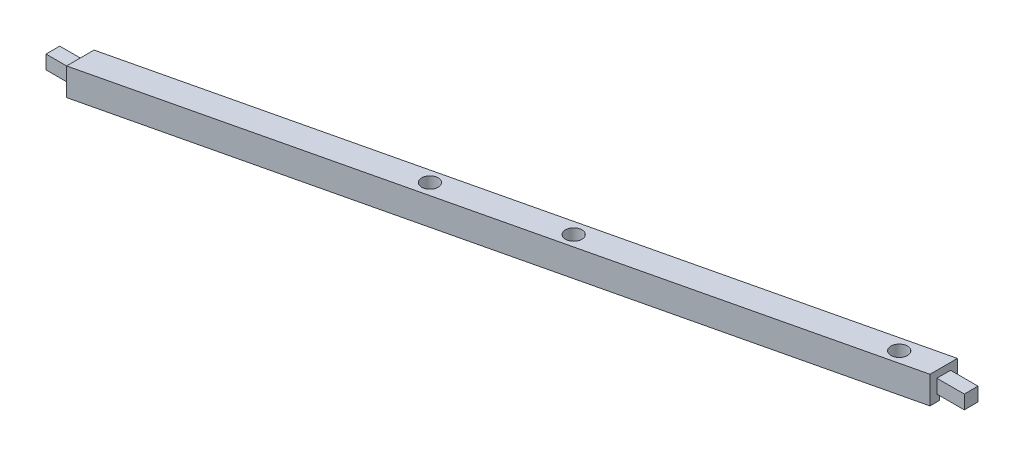
from build123d import *

# Parameters (mm, degrees)
BOSS_EXTRUDE1_DEPTH = 5
SKETCH2_W           = 2.5
SKETCH2_H           = 2.5
BOSS_EXTRUDE2_DEPTH = 5
SKETCH3_W           = 2.5
SKETCH3_H           = 2.5
BOSS_EXTRUDE3_DEPTH = 5
SKETCH6_R           = 1.5
CUT_EXTRUDE1_DEPTH  = 5
CUT_EXTRUDE2_DEPTH  = 2


with BuildPart() as part:
    # Sketch1 → Boss-Extrude1 (new body)
    with BuildSketch(Plane(origin=(0, 0, 0), x_dir=(1, 0, 0), z_dir=(0, 1, 0))):
        Polygon((0, 5), (0, 0), (127.3, 30), (127.3, 35), align=None)
    extrude(amount=BOSS_EXTRUDE1_DEPTH)

    # Sketch2 → Boss-Extrude2 (add)
    with BuildSketch(Plane(origin=(127.3, 0, 0), x_dir=(0, 0, -1), z_dir=(1, 0, 0))):
        with Locations((32.5, 2.5)):
            Rectangle(SKETCH2_W, SKETCH2_H)
    extrude(amount=BOSS_EXTRUDE2_DEPTH)

    # Sketch3 → Boss-Extrude3 (add)
    with BuildSketch(Plane.ZY):
        with Locations((-2.5, 2.5)):
            Rectangle(SKETCH3_W, SKETCH3_H)
    extrude(amount=BOSS_EXTRUDE3_DEPTH)

    # Sketch6 → Cut-Extrude1 (cut)
    with BuildSketch(Plane.XZ):
        with Locations(Location((51.5, -14.705168766, 0), (0, 0, 270))):
            Circle(SKETCH6_R)
        with Locations(Location((72.8, -19.587839875, 0), (0, 0, 270))):
            Circle(SKETCH6_R)
        with Locations(Location((120.8, -30.899701619, 0), (0, 0, 270))):
            Circle(SKETCH6_R)
    extrude(amount=-CUT_EXTRUDE1_DEPTH, mode=Mode.SUBTRACT)

    # Sketch7 → Cut-Extrude2 (cut)
    with BuildSketch(Plane(origin=(0, 0, 0), x_dir=(-1, 0, 0), z_dir=(0, -1, 0))):
        Polygon((0, 3.25), (-127.3, 33.25), (-127.3, 31.75), (0, 1.75), align=None)
    extrude(amount=-CUT_EXTRUDE2_DEPTH, mode=Mode.SUBTRACT)


solid = part.part
